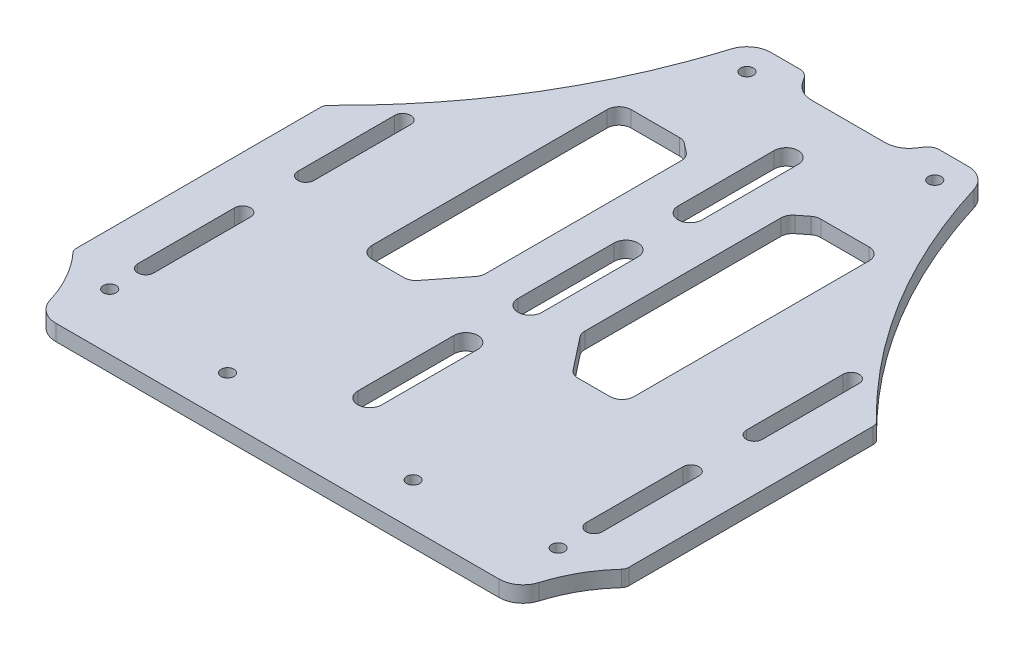
from build123d import *

# Parameters (mm, degrees)
SKETCH3_R               = 1.6
BOSS_EXTRUDE1_DEPTH     = 4
BOSS_EXTRUDE2_DEPTH     = 4
CUT_EXTRUDE1_DEPTH      = 107.208312219
CUT_EXTRUDE1_DEPTH_BACK = 107.208312219
FILLET1_R               = 2
FILLET2_R               = 2


with BuildPart() as part:
    # Sketch3 → Boss-Extrude1 (new body)
    with BuildSketch(Plane(origin=(0, 0, 0), x_dir=(1, 0, 0), z_dir=(0, 1, 0))):
        with BuildLine():
            ThreePointArc((-73.029142624, 1.757624222), (-74.485200805, -0.256695741), (-75, -2.688273856))
            Line((-75, -2.688273856), (-75, -48.998688468))
            ThreePointArc((-75, -48.998688468), (-74.409604655, -51.594103171), (-72.754607506, -53.678744287))
            add(Edge.make_bspline(
                [(-72.754607506, -53.678744287), (-69.155494376, -56.566157963), (-64.599200983, -61.832292074), (-61.843913564, -68.281231903), (-61.080449761, -70.821562762)],
                knots=[0.094602327, 0.094602327, 0.094602327, 0.094602327, 0.56783984, 0.847958174, 0.847958174, 0.847958174, 0.847958174], degree=3))
            ThreePointArc((-61.080449761, -70.821562762), (-58.914739386, -73.90928377), (-55.334342253, -75.094643974))
            Line((-55.334342253, -75.094643974), (55.334342253, -75.094643974))
            ThreePointArc((55.334342253, -75.094643974), (58.914739386, -73.90928377), (61.080449761, -70.821562762))
            add(Edge.make_bspline(
                [(72.754607506, -53.678744287), (69.155494376, -56.566157963), (64.599200983, -61.832292074), (61.843913564, -68.281231903), (61.080449761, -70.821562762)],
                knots=[0.094602327, 0.094602327, 0.094602327, 0.094602327, 0.56783984, 0.847958174, 0.847958174, 0.847958174, 0.847958174], degree=3))
            ThreePointArc((72.754607506, -53.678744287), (74.409604655, -51.594103171), (75, -48.998688468))
            Line((75, -48.998688468), (75, -2.688273856))
            ThreePointArc((75, -2.688273856), (74.485200805, -0.256695741), (73.029142624, 1.757624222))
            add(Edge.make_bspline(
                [(73.029142624, 1.757624222), (61.044308879, 12.619007824), (44.264997441, 33.305814104), (33.66455996, 57.788254978), (30.349409152, 68.542031425)],
                knots=[0.029323898, 0.029323898, 0.029323898, 0.029323898, 0.569457767, 0.950406717, 0.950406717, 0.950406717, 0.950406717], degree=3))
            ThreePointArc((30.349409152, 68.542031425), (28.179000339, 71.601741431), (24.615679564, 72.774449742))
            Line((24.615679564, 72.774449742), (17.482147291, 72.774449742))
            ThreePointArc((17.482147291, 72.774449742), (16.080583841, 72.426924039), (15.003739939, 71.464863006))
            Line((15.003739939, 71.464863006), (14.10601108, 70.148653619))
            ThreePointArc((14.10601108, 70.148653619), (11.952323278, 68.224531553), (9.149196378, 67.529480146))
            Line((9.149196378, 67.529480146), (5.71201358, 67.529480146))
            Line((5.71201358, 67.529480146), (-5.71201358, 67.529480146))
            Line((-5.71201358, 67.529480146), (-9.149196378, 67.529480146))
            ThreePointArc((-9.149196378, 67.529480146), (-11.952323278, 68.224531553), (-14.10601108, 70.148653619))
            Line((-14.10601108, 70.148653619), (-15.003739939, 71.464863006))
            ThreePointArc((-15.003739939, 71.464863006), (-16.080583841, 72.426924039), (-17.482147291, 72.774449742))
            Line((-17.482147291, 72.774449742), (-24.615679564, 72.774449742))
            ThreePointArc((-24.615679564, 72.774449742), (-28.179000339, 71.601741431), (-30.349409152, 68.542031425))
            add(Edge.make_bspline(
                [(-73.029142624, 1.757624222), (-61.044308879, 12.619007824), (-44.264997441, 33.305814104), (-33.66455996, 57.788254978), (-30.349409152, 68.542031425)],
                knots=[0.029323898, 0.029323898, 0.029323898, 0.029323898, 0.569457767, 0.950406717, 0.950406717, 0.950406717, 0.950406717], degree=3))
        make_face()
        with Locations(Location((-56, -61, 0), (0, 0, 270))):
            Circle(SKETCH3_R, mode=Mode.SUBTRACT)
        with BuildLine():
            Line((-54, -27.815735365), (-54, -52))
            ThreePointArc((-54, -52), (-56, -54), (-58, -52))
            Line((-58, -52), (-58, -27.815735365))
            ThreePointArc((-58, -27.815735365), (-56, -25.815735365), (-54, -27.815735365))
        make_face(mode=Mode.SUBTRACT)
        with Locations(Location((-23.16862443, -64.386702544, 0), (0, 0, 270))):
            Circle(SKETCH3_R, mode=Mode.SUBTRACT)
        with Locations(Location((23.16862443, -64.386702544, 0), (0, 0, 270))):
            Circle(SKETCH3_R, mode=Mode.SUBTRACT)
        with BuildLine():
            ThreePointArc((3, -52.03567912), (0, -55.03567912), (-3, -52.03567912))
            Line((-3, -52.03567912), (-3, -28.03567912))
            ThreePointArc((-3, -28.03567912), (0, -25.03567912), (3, -28.03567912))
            Line((3, -28.03567912), (3, -52.03567912))
        make_face(mode=Mode.SUBTRACT)
        with Locations(Location((56, -61, 0), (0, 0, 270))):
            Circle(SKETCH3_R, mode=Mode.SUBTRACT)
        with BuildLine():
            ThreePointArc((58, -52), (56, -54), (54, -52))
            Line((54, -52), (54, -27.815735365))
            ThreePointArc((54, -27.815735365), (56, -25.815735365), (58, -27.815735365))
            Line((58, -27.815735365), (58, -52))
        make_face(mode=Mode.SUBTRACT)
        with BuildLine():
            Line((-54, 12.184264635), (-54, -12))
            ThreePointArc((-54, -12), (-56, -14), (-58, -12))
            Line((-58, -12), (-58, 12.184264635))
            ThreePointArc((-58, 12.184264635), (-56, 14.184264635), (-54, 12.184264635))
        make_face(mode=Mode.SUBTRACT)
        with BuildLine():
            Line((-32.722260611, -18.764434552), (-32.722260611, 39.955234216))
            ThreePointArc((-32.722260611, 39.955234216), (-31.843580954, 42.07655456), (-29.722260611, 42.955234216))
            Line((-29.722260611, 42.955234216), (-17.648417807, 42.955234216))
            ThreePointArc((-17.648417807, 42.955234216), (-16.667808417, 42.790442361), (-15.794929987, 42.314171032))
            Line((-15.794929987, 42.314171032), (-13.559239731, 40.557521751))
            ThreePointArc((-13.559239731, 40.557521751), (-12.714537097, 39.509984291), (-12.412727552, 38.198584936))
            Line((-12.412727552, 38.198584936), (-12.412727552, -10.734024286))
            ThreePointArc((-12.412727552, -10.734024286), (-12.577519407, -11.714633677), (-13.053790737, -12.587512107))
            Line((-13.053790737, -12.587512107), (-19.363526346, -20.617922372))
            ThreePointArc((-19.363526346, -20.617922372), (-20.411063806, -21.462625007), (-21.722463161, -21.764434552))
            Line((-21.722463161, -21.764434552), (-29.722260611, -21.764434552))
            ThreePointArc((-29.722260611, -21.764434552), (-31.843580954, -20.885754895), (-32.722260611, -18.764434552))
        make_face(mode=Mode.SUBTRACT)
        with Locations(Location((-23.456493673, 65.613297456, 0), (0, 0, 270))):
            Circle(SKETCH3_R, mode=Mode.SUBTRACT)
        with BuildLine():
            ThreePointArc((3, -12.03567912), (0, -15.03567912), (-3, -12.03567912))
            Line((-3, -12.03567912), (-3, 11.96432088))
            ThreePointArc((-3, 11.96432088), (0, 14.96432088), (3, 11.96432088))
            Line((3, 11.96432088), (3, -12.03567912))
        make_face(mode=Mode.SUBTRACT)
        with BuildLine():
            ThreePointArc((12.412727552, 38.198584936), (12.714537097, 39.509984291), (13.559239731, 40.557521751))
            Line((13.559239731, 40.557521751), (15.794929987, 42.314171032))
            ThreePointArc((15.794929987, 42.314171032), (16.667808417, 42.790442361), (17.648417807, 42.955234216))
            Line((17.648417807, 42.955234216), (29.722260611, 42.955234216))
            ThreePointArc((29.722260611, 42.955234216), (31.843580954, 42.07655456), (32.722260611, 39.955234216))
            Line((32.722260611, 39.955234216), (32.722260611, -18.764434552))
            ThreePointArc((32.722260611, -18.764434552), (31.843580954, -20.885754895), (29.722260611, -21.764434552))
            Line((29.722260611, -21.764434552), (21.722463161, -21.764434552))
            ThreePointArc((21.722463161, -21.764434552), (20.411063806, -21.462625007), (19.363526346, -20.617922372))
            Line((19.363526346, -20.617922372), (13.053790737, -12.587512107))
            ThreePointArc((13.053790737, -12.587512107), (12.577519407, -11.714633677), (12.412727552, -10.734024286))
            Line((12.412727552, -10.734024286), (12.412727552, 38.198584936))
        make_face(mode=Mode.SUBTRACT)
        with BuildLine():
            ThreePointArc((58, -12), (56, -14), (54, -12))
            Line((54, -12), (54, 12.184264635))
            ThreePointArc((54, 12.184264635), (56, 14.184264635), (58, 12.184264635))
            Line((58, 12.184264635), (58, -12))
        make_face(mode=Mode.SUBTRACT)
        with BuildLine():
            ThreePointArc((3, 27.96432088), (0, 24.96432088), (-3, 27.96432088))
            Line((-3, 27.96432088), (-3, 51.96432088))
            ThreePointArc((-3, 51.96432088), (0, 54.96432088), (3, 51.96432088))
            Line((3, 51.96432088), (3, 27.96432088))
        make_face(mode=Mode.SUBTRACT)
        with Locations(Location((16, 54.96432088, 0), (0, 0, 270))):
            Circle(SKETCH3_R, mode=Mode.SUBTRACT)
        with Locations(Location((23.456493673, 65.613297456, 0), (0, 0, 270))):
            Circle(SKETCH3_R, mode=Mode.SUBTRACT)
    extrude(amount=BOSS_EXTRUDE1_DEPTH)

    # Sketch5 → Boss-Extrude2 (add)
    with BuildSketch(Plane(origin=(0, 4, 0), x_dir=(1, 0, 0), z_dir=(0, 1, 0))):
        Polygon((15.245312242, 58.61530822), (12.156907233, 54.222909984), (18.333717252, 47.016631629), (24.002436461, 55.07881006), align=None)
    extrude(amount=-BOSS_EXTRUDE2_DEPTH)

    # Sketch7 → Cut-Extrude1 (cut, two sides: drawn at the far end of the back side and taken through both)
    with BuildSketch(Plane(origin=(0, 4, 0), x_dir=(1, 0, 0), z_dir=(0, 1, 0)).offset(-CUT_EXTRUDE1_DEPTH_BACK)):
        with BuildLine():
            ThreePointArc((-75, -48.998688468), (-74.409604655, -51.594103171), (-72.754607506, -53.678744287))
            add(Edge.make_bspline(
                [(-72.754607506, -53.678744287), (-71.398986726, -54.766300537), (-70.147919267, -55.913530515), (-69, -57.122898046)],
                knots=[0.094602327, 0.094602327, 0.094602327, 0.094602327, 0.272849185, 0.272849185, 0.272849185, 0.272849185], degree=3))
            Line((-69, -57.122898046), (-69, 5.535291358))
            add(Edge.make_bspline(
                [(-73.029142624, 1.757624222), (-71.658027629, 3.000211832), (-70.314990302, 4.259416425), (-69, 5.535291358)],
                knots=[0.029323898, 0.029323898, 0.029323898, 0.029323898, 0.091117467, 0.091117467, 0.091117467, 0.091117467], degree=3))
            ThreePointArc((-73.029142624, 1.757624222), (-74.485200805, -0.256695741), (-75, -2.688273856))
            Line((-75, -2.688273856), (-75, -48.998688468))
        make_face()
        with BuildLine():
            Line((69, 5.535291358), (69, -57.122898046))
            add(Edge.make_bspline(
                [(69, -57.122898046), (70.147919267, -55.913530515), (71.398986726, -54.766300537), (72.754607506, -53.678744287)],
                knots=[0.669711316, 0.669711316, 0.669711316, 0.669711316, 0.847958174, 0.847958174, 0.847958174, 0.847958174], degree=3))
            ThreePointArc((72.754607506, -53.678744287), (74.409604655, -51.594103171), (75, -48.998688468))
            Line((75, -48.998688468), (75, -2.688273856))
            ThreePointArc((75, -2.688273856), (74.485200805, -0.256695741), (73.029142624, 1.757624222))
            add(Edge.make_bspline(
                [(73.029142624, 1.757624222), (71.658027629, 3.000211832), (70.314990302, 4.259416425), (69, 5.535291358)],
                knots=[0.029323898, 0.029323898, 0.029323898, 0.029323898, 0.091117467, 0.091117467, 0.091117467, 0.091117467], degree=3))
        make_face()
    extrude(amount=CUT_EXTRUDE1_DEPTH + CUT_EXTRUDE1_DEPTH_BACK, mode=Mode.SUBTRACT)

    # Fillet1
    fillet1_edges = [part.edges().sort_by_distance(p)[0] for p in [
        (-69, 2, -5.535291358),
    ]]
    fillet(fillet1_edges, radius=FILLET1_R)

    # Fillet2
    fillet2_edges = [part.edges().sort_by_distance(p)[0] for p in [
        (-69, 2, 57.122898046),
        (69, 2, 57.122898046),
        (69, 2, -5.535291358),
    ]]
    fillet(fillet2_edges, radius=FILLET2_R)


solid = part.part
